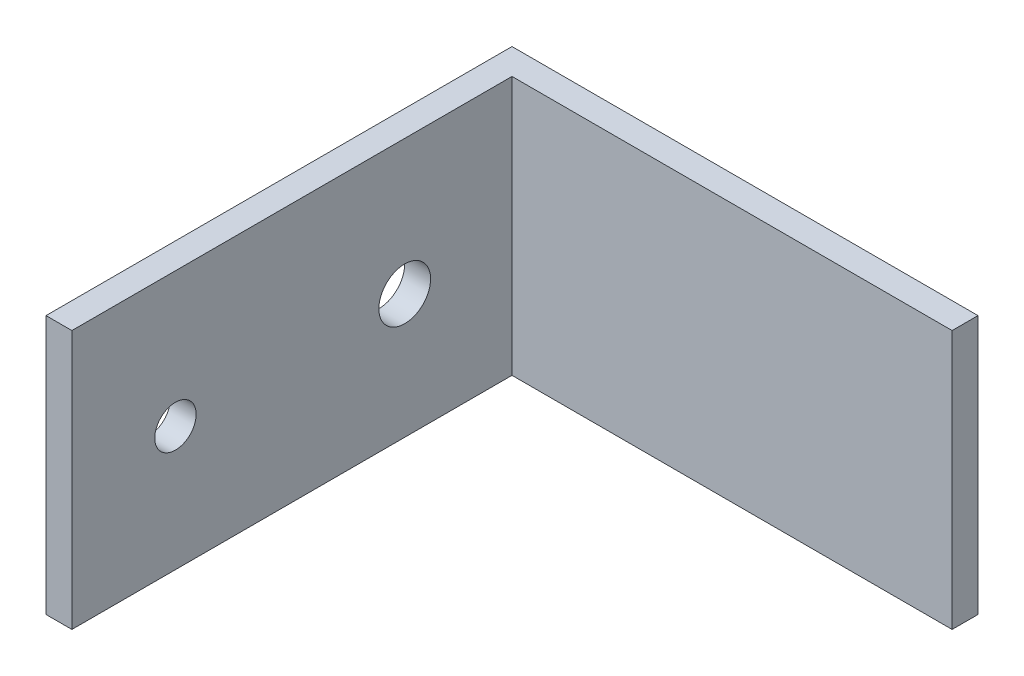
from build123d import *

# Parameters (mm, degrees)
SKETCH1_W           = 85
SKETCH1_H           = 50
BOSS_EXTRUDE1_DEPTH = 5
SKETCH2_W           = 90
SKETCH2_H           = 50
BOSS_EXTRUDE2_DEPTH = 5
SKETCH3_R           = 4
SKETCH3_R_2         = 5
CUT_EXTRUDE1_DEPTH  = 5


with BuildPart() as part:
    # Sketch1 → Boss-Extrude1 (new body)
    with BuildSketch(Plane.XY):
        with Locations((42.5, -25)):
            Rectangle(SKETCH1_W, SKETCH1_H)
    extrude(amount=BOSS_EXTRUDE1_DEPTH)

    # Sketch2 → Boss-Extrude2 (add)
    with BuildSketch(Plane.ZY):
        with Locations((45, -25)):
            Rectangle(SKETCH2_W, SKETCH2_H)
    extrude(amount=BOSS_EXTRUDE2_DEPTH)

    # Sketch3 → Cut-Extrude1 (cut)
    with BuildSketch(Plane.ZY.offset(5)):
        with Locations(Location((70, -26, 0), (0, 0, 270))):
            Circle(SKETCH3_R)
        with Locations(Location((25.72, -26, 0), (0, 0, 270))):
            Circle(SKETCH3_R_2)
    extrude(amount=-CUT_EXTRUDE1_DEPTH, mode=Mode.SUBTRACT)


solid = part.part
